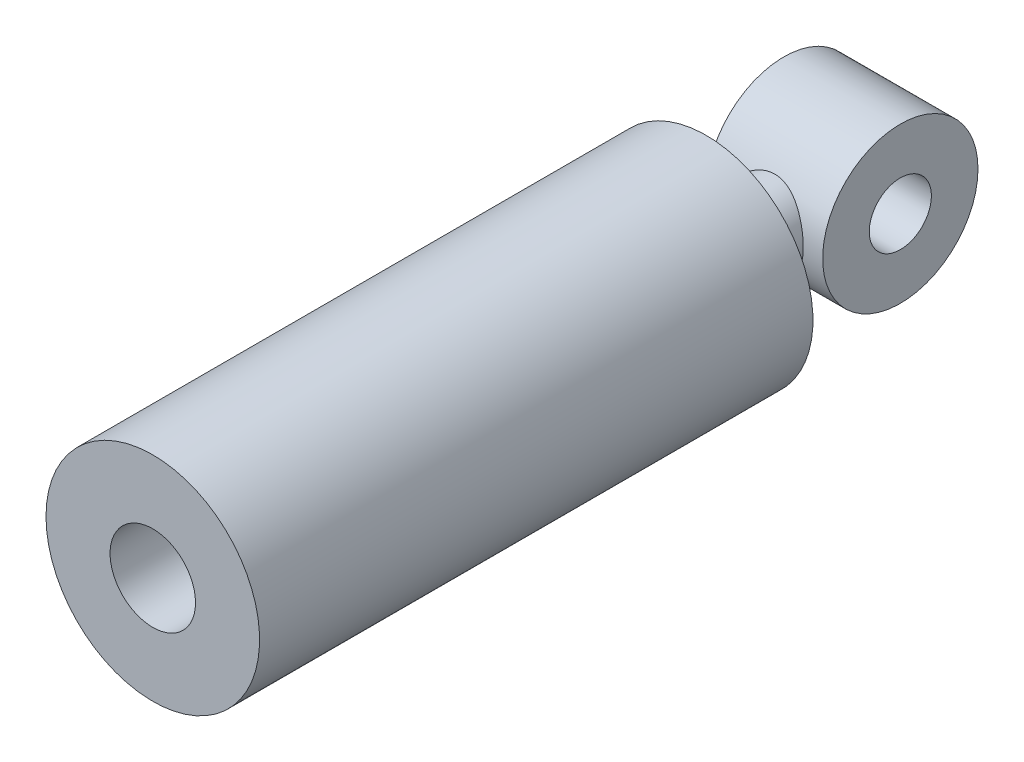
from build123d import *

# Parameters (mm, degrees)
F_0000_CYLINDER_SKETCH_R     = 5.5
F_0000_CYLINDER_DEPTH        = 28.5
F_0002_CYLINDER_SKETCH_R     = 2.2
F_0002_CYLINDER_DEPTH        = 24.5
F_0005_CYLINDER_SKETCH_R     = 2
F_0005_CYLINDER_DEPTH        = 6
F_0008_CYLINDER_SKETCH_R     = 4
F_0008_CYLINDER_DEPTH        = 6
F_0008_CYLINDER_ROTATE_ANGLE = 90
F_0010_CYLINDER_SKETCH_R     = 1.6
F_0010_CYLINDER_DEPTH        = 8
F_0010_CYLINDER_ROTATE_ANGLE = 90


with BuildPart() as part:
    # 0000_cylinder_Sketch → 0000_cylinder (new body)
    with BuildSketch(Plane.XY):
        with Locations(Location((0, 0, 0), (0, 0, 180))):
            Circle(F_0000_CYLINDER_SKETCH_R)
    extrude(amount=F_0000_CYLINDER_DEPTH)


with BuildPart() as part_1:
    # 0000_cylinder_Translate: moved
    add(part.part.moved(Location((0, 0, 7))))


with BuildPart() as body_2:
    # 0002_cylinder_Sketch → 0002_cylinder (new body)
    with BuildSketch(Plane.XY):
        Circle(F_0002_CYLINDER_SKETCH_R)
    extrude(amount=F_0002_CYLINDER_DEPTH)


with BuildPart() as body_2_1:
    # 0002_cylinder_Translate: moved
    add(body_2.part.moved(Location((0, 0, 12))))


with BuildPart() as part_2:
    add(part_1.part)

    # 0004_sub: cut body 2
    add(body_2_1.part, mode=Mode.SUBTRACT)


with BuildPart() as body_2_2:
    # 0005_cylinder_Sketch → 0005_cylinder (new body)
    with BuildSketch(Plane.XY):
        Circle(F_0005_CYLINDER_SKETCH_R)
    extrude(amount=F_0005_CYLINDER_DEPTH)


with BuildPart() as body_2_2_1:
    # 0005_cylinder_Translate: moved
    add(body_2_2.part.moved(Location((0, 0, 3))))


with BuildPart() as part_3:
    add(part_2.part)

    # 0007_add: union body 2 2
    add(body_2_2_1.part)


with BuildPart() as body_2_3:
    # 0008_cylinder_Sketch → 0008_cylinder (new body)
    with BuildSketch(Plane.XY):
        Circle(F_0008_CYLINDER_SKETCH_R)
    extrude(amount=F_0008_CYLINDER_DEPTH)


with BuildPart() as body_2_3_1:
    # 0008_cylinder_Rotate: moved
    add(body_2_3.part.rotate(Axis((0, 0, 0), (0, 1, 0)), F_0008_CYLINDER_ROTATE_ANGLE))


with BuildPart() as body_2_3_2:
    # 0008_cylinder_Translate: moved
    add(body_2_3_1.part.moved(Location((-3, 0, 0))))


with BuildPart() as part_4:
    add(part_3.part)

    # 0009_add: union body 2 3
    add(body_2_3_2.part)


with BuildPart() as body_2_4:
    # 0010_cylinder_Sketch → 0010_cylinder (new body)
    with BuildSketch(Plane.XY):
        Circle(F_0010_CYLINDER_SKETCH_R)
    extrude(amount=F_0010_CYLINDER_DEPTH)


with BuildPart() as body_2_4_1:
    # 0010_cylinder_Rotate: moved
    add(body_2_4.part.rotate(Axis((0, 0, 0), (0, 1, 0)), F_0010_CYLINDER_ROTATE_ANGLE))


with BuildPart() as body_2_4_2:
    # 0010_cylinder_Translate: moved
    add(body_2_4_1.part.moved(Location((-4, 0, 0))))


with BuildPart() as part_5:
    add(part_4.part)

    # 0011_sub: cut body 2 4
    add(body_2_4_2.part, mode=Mode.SUBTRACT)


solid = part_5.part
